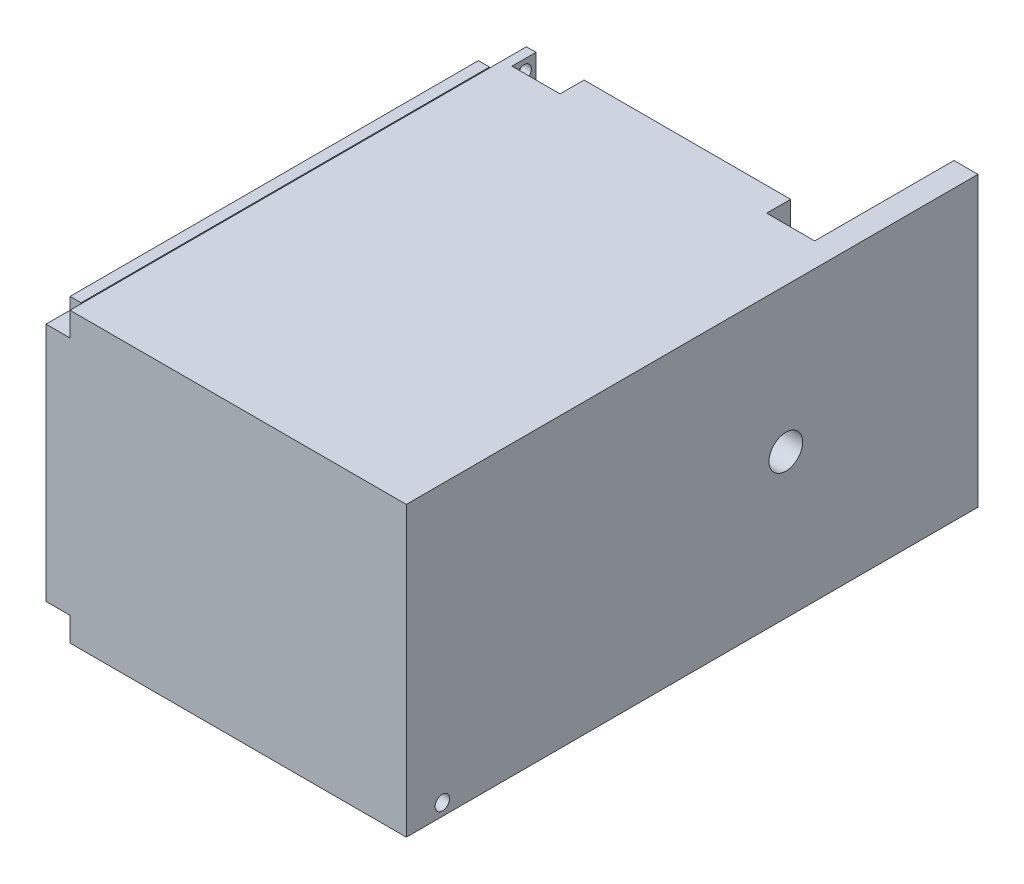
from build123d import *

# Parameters (mm, degrees)
VOLUME_BOITIER_DEPTH     = 90
ESQUISSE2_W              = 75
ESQUISSE2_H              = 60
FACE_INF_RIEURE_DEPTH    = 5
ESQUISSE3_W              = 5
ESQUISSE3_H              = 60
FACE_PILE_DEPTH          = 24
ENL_V_MAT_EXTRU_6_REACH  = 137.093
ESQUISSE11_R             = 3.5
ESQUISSE11_R_2           = 1.5
ESQUISSE12_W             = 3
ESQUISSE12_H             = 2
BOSS_EXTRU_7_DEPTH       = 85
ESQUISSE13_R             = 1.5
ESQUISSE13_R_2           = 1.527028633
ENL_V_MAT_EXTRU_7_DEPTH  = 20
ESQUISSE14_W             = 10
ESQUISSE14_H             = 5
ENL_V_MAT_EXTRU_8_DEPTH  = 5
ENL_V_MAT_EXTRU_9_REACH  = 129.475
ESQUISSE15_R             = 1.1
ENL_V_MAT_EXTRU_10_DEPTH = 90
ESQUISSE17_W             = 5
ESQUISSE17_H             = 5
ENL_V_MAT_EXTRU_11_DEPTH = 5
ESQUISSE18_W             = 2.3
ESQUISSE18_H             = 2.5
ENL_V_MAT_EXTRU_12_DEPTH = 5
ENL_V_MAT_EXTRU_13_REACH = 137.093
ESQUISSE20_W             = 15
ESQUISSE20_H             = 15
ENL_V_MAT_EXTRU_14_REACH = 129.475
ESQUISSE21_W             = 15
ESQUISSE21_H             = 10
ESQUISSE22_R             = 1.5
ENL_V_MAT_EXTRU_15_DEPTH = 10


with BuildPart() as part:
    # Esquisse1 → volume boitier (new body)
    with BuildSketch(Plane.XY):
        Polygon((0, 60), (0, 0), (7, 0), (7, 55), (70, 55), (70, 0), (75, 0), (75, 60), align=None)
    extrude(amount=VOLUME_BOITIER_DEPTH)

    # Esquisse2 → face inférieure (add)
    with BuildSketch(Plane.XY.offset(90)):
        with Locations((37.5, 30)):
            Rectangle(ESQUISSE2_W, ESQUISSE2_H)
    extrude(amount=FACE_INF_RIEURE_DEPTH)

    # Esquisse3 → face pile (add)
    with BuildSketch(Plane(origin=(0, 0, 0), x_dir=(-1, 0, 0), z_dir=(0, 0, -1))):
        with Locations((-72.5, 30)):
            Rectangle(ESQUISSE3_W, ESQUISSE3_H)
    extrude(amount=FACE_PILE_DEPTH)

    # Esquisse11 → Enlèv. mat.-Extru.6 (cut, up to next)
    with BuildSketch(Plane(origin=(75, 0, 0), x_dir=(0, 0, -1), z_dir=(1, 0, 0)), mode=Mode.PRIVATE) as enl_v_mat_extru_6_sk1:
        with Locations((-16, 30)):
            Circle(ESQUISSE11_R)
    enl_v_mat_extru_6_tool1 = extrude(enl_v_mat_extru_6_sk1.sketch, amount=-ENL_V_MAT_EXTRU_6_REACH, mode=Mode.PRIVATE) & part.part
    # Esquisse11 → Enlèv. mat.-Extru.6 (cut, up to next)
    with BuildSketch(Plane(origin=(75, 0, 0), x_dir=(0, 0, -1), z_dir=(1, 0, 0)), mode=Mode.PRIVATE) as enl_v_mat_extru_6_sk2:
        with Locations((-87.5, 2.5)):
            Circle(ESQUISSE11_R_2)
    enl_v_mat_extru_6_tool2 = extrude(enl_v_mat_extru_6_sk2.sketch, amount=-ENL_V_MAT_EXTRU_6_REACH, mode=Mode.PRIVATE) & part.part
    add(enl_v_mat_extru_6_tool1.solids().sort_by_distance((75, 30, 16))[0], mode=Mode.SUBTRACT)
    add(enl_v_mat_extru_6_tool2.solids().sort_by_distance((75, 2.5, 87.5))[0], mode=Mode.SUBTRACT)

    # Esquisse12 → Boss.-Extru.7 (add)
    with BuildSketch(Plane(origin=(0, 0, 90), x_dir=(-1, 0, 0), z_dir=(0, 0, -1))):
        Polygon((-70, 20), (-70, 23), (-27, 23), (-27, 15), (-29, 15), (-29, 20), align=None)
        with Locations((-68.5, 6)):
            Rectangle(ESQUISSE12_W, ESQUISSE12_H)
        with Locations((-8.5, 6)):
            Rectangle(ESQUISSE12_W, ESQUISSE12_H)
    extrude(amount=BOSS_EXTRU_7_DEPTH)

    # Esquisse13 → Enlèv. mat.-Extru.7 (cut)
    with BuildSketch(Plane.ZY):
        with Locations((2.5, 2.5)):
            Circle(ESQUISSE13_R)
        with Locations((2.5, 57.5)):
            Circle(ESQUISSE13_R_2)
    extrude(amount=-ENL_V_MAT_EXTRU_7_DEPTH, mode=Mode.SUBTRACT)

    # Esquisse14 → Enlèv. mat.-Extru.8 (cut)
    with BuildSketch(Plane(origin=(0, 0, 0), x_dir=(-1, 0, 0), z_dir=(0, 0, -1))):
        with Locations((-65, 57.5)):
            Rectangle(ESQUISSE14_W, ESQUISSE14_H)
        with Locations((-12, 57.5)):
            Rectangle(ESQUISSE14_W, ESQUISSE14_H)
    extrude(amount=-ENL_V_MAT_EXTRU_8_DEPTH, mode=Mode.SUBTRACT)

    # Esquisse15 → Enlèv. mat.-Extru.9 (cut, up to next)
    with BuildSketch(Plane.XZ.offset(-20), mode=Mode.PRIVATE) as enl_v_mat_extru_9_sk1:
        with Locations((33, 70)):
            Circle(ESQUISSE15_R)
    enl_v_mat_extru_9_tool1 = extrude(enl_v_mat_extru_9_sk1.sketch, amount=-ENL_V_MAT_EXTRU_9_REACH, mode=Mode.PRIVATE) & part.part
    add(enl_v_mat_extru_9_tool1.solids().sort_by_distance((33, 20, 70))[0], mode=Mode.SUBTRACT)

    # Esquisse16 → Enlèv. mat.-Extru.10 (cut)
    with BuildSketch(Plane.XY.offset(95)):
        Polygon((0, 2.5), (2.3, 2.5), (2.3, 5), (5, 5), (5, 0), (0, 0), align=None)
        Polygon((0, 60), (0, 57.5), (2.3, 57.5), (2.3, 55), (5, 55), (5, 60), align=None)
    extrude(amount=-ENL_V_MAT_EXTRU_10_DEPTH, mode=Mode.SUBTRACT)

    # Esquisse17 → Enlèv. mat.-Extru.11 (cut)
    with BuildSketch(Plane.ZY):
        with Locations((2.5, 2.5)):
            Rectangle(ESQUISSE17_W, ESQUISSE17_H)
        with Locations((2.5, 57.5)):
            Rectangle(ESQUISSE17_W, ESQUISSE17_H)
    extrude(amount=-ENL_V_MAT_EXTRU_11_DEPTH, mode=Mode.SUBTRACT)

    # Esquisse18 → Enlèv. mat.-Extru.12 (cut)
    with BuildSketch(Plane.XY.offset(95)):
        with Locations((1.15, 3.75)):
            Rectangle(ESQUISSE18_W, ESQUISSE18_H)
        with Locations((1.15, 56.25)):
            Rectangle(ESQUISSE18_W, ESQUISSE18_H)
    extrude(amount=-ENL_V_MAT_EXTRU_12_DEPTH, mode=Mode.SUBTRACT)

    # Esquisse20 → Enlèv. mat.-Extru.13 (cut, up to next)
    with BuildSketch(Plane.ZY, mode=Mode.PRIVATE) as enl_v_mat_extru_13_sk1:
        with Locations((27.5, 30)):
            Rectangle(ESQUISSE20_W, ESQUISSE20_H)
    enl_v_mat_extru_13_tool1 = extrude(enl_v_mat_extru_13_sk1.sketch, amount=-ENL_V_MAT_EXTRU_13_REACH, mode=Mode.PRIVATE) & part.part
    # Esquisse20 → Enlèv. mat.-Extru.13 (cut, up to next)
    with BuildSketch(Plane.ZY, mode=Mode.PRIVATE) as enl_v_mat_extru_13_sk2:
        with Locations((67.5, 30)):
            Rectangle(ESQUISSE20_W, ESQUISSE20_H)
    enl_v_mat_extru_13_tool2 = extrude(enl_v_mat_extru_13_sk2.sketch, amount=-ENL_V_MAT_EXTRU_13_REACH, mode=Mode.PRIVATE) & part.part
    add(enl_v_mat_extru_13_tool1.solids().sort_by_distance((0, 30, 27.5))[0], mode=Mode.SUBTRACT)
    add(enl_v_mat_extru_13_tool2.solids().sort_by_distance((0, 30, 67.5))[0], mode=Mode.SUBTRACT)

    # Esquisse21 → Enlèv. mat.-Extru.14 (cut, up to next)
    with BuildSketch(Plane.XZ.offset(-20), mode=Mode.PRIVATE) as enl_v_mat_extru_14_sk1:
        with Locations((49.5, 67)):
            Rectangle(ESQUISSE21_W, ESQUISSE21_H)
    enl_v_mat_extru_14_tool1 = extrude(enl_v_mat_extru_14_sk1.sketch, amount=-ENL_V_MAT_EXTRU_14_REACH, mode=Mode.PRIVATE) & part.part
    add(enl_v_mat_extru_14_tool1.solids().sort_by_distance((49.5, 20, 67))[0], mode=Mode.SUBTRACT)

    # Esquisse22 → Enlèv. mat.-Extru.15 (cut)
    with BuildSketch(Plane.XZ.offset(-5)):
        with Locations(Location((2.5, 92.5, 0), (0, 0, 270))):
            Circle(ESQUISSE22_R)
    extrude(amount=-ENL_V_MAT_EXTRU_15_DEPTH, mode=Mode.SUBTRACT)


solid = part.part
